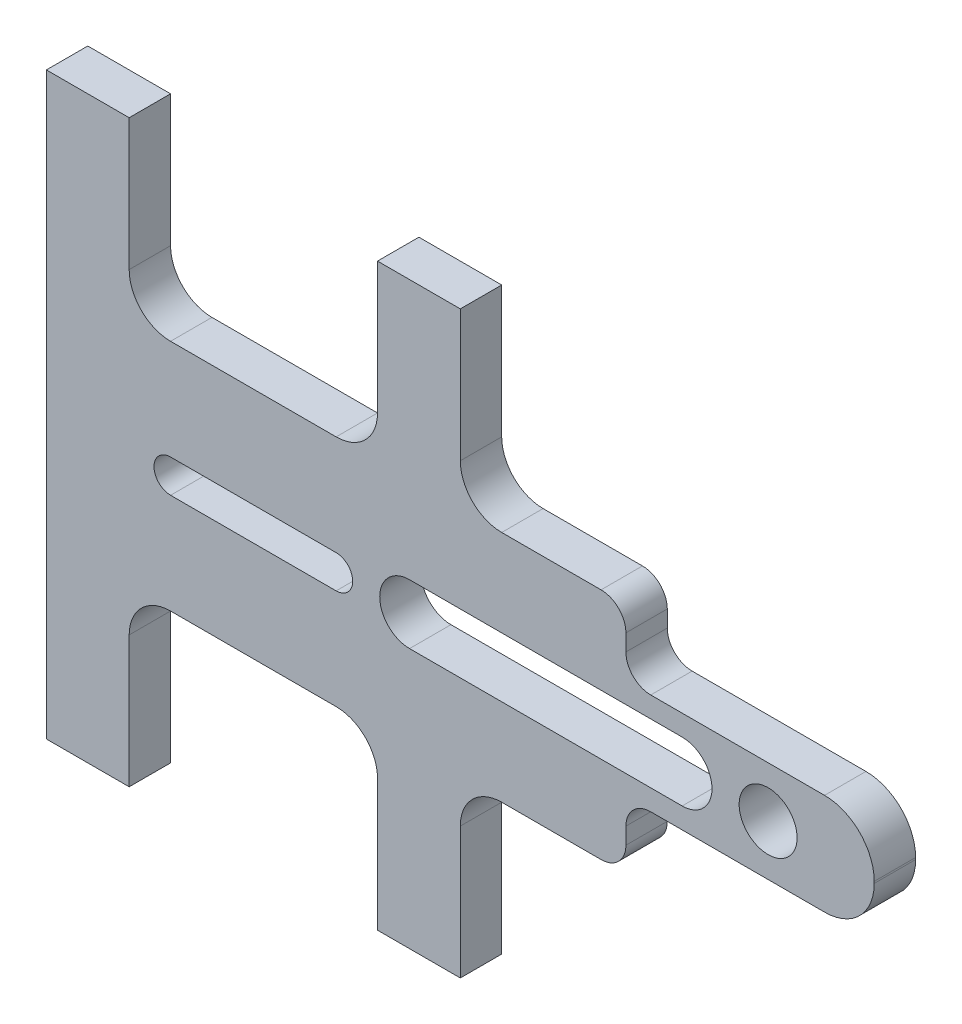
from build123d import *

# Parameters (mm, degrees)
SKETCH1_R           = 1.75
BOSS_EXTRUDE1_DEPTH = 2.5


with BuildPart() as part:
    # Sketch1 → Boss-Extrude1 (new body)
    with BuildSketch(Plane.XY):
        with BuildLine():
            Line((0, -17.5), (0, 17.5))
            Line((0, 17.5), (5, 17.5))
            Line((5, 17.5), (5, 9.554775034))
            ThreePointArc((5, 9.554775034), (5.732233047, 7.787008081), (7.5, 7.054775034))
            Line((7.5, 7.054775034), (17.5, 7.054775034))
            ThreePointArc((17.5, 7.054775034), (19.267766953, 7.787008081), (20, 9.554775034))
            Line((20, 9.554775034), (20, 17.5))
            Line((20, 17.5), (25, 17.5))
            Line((25, 17.5), (25, 9.554775034))
            ThreePointArc((25, 9.554775034), (25.732233047, 7.787008081), (27.5, 7.054775034))
            Line((27.5, 7.054775034), (33.501638743, 7.054775034))
            ThreePointArc((33.501638743, 7.054775034), (34.562298915, 6.615435205), (35.001638743, 5.554775034))
            Line((35.001638743, 5.554775034), (35.001638743, 4.554775034))
            ThreePointArc((35.001638743, 4.554775034), (35.440978571, 3.494114862), (36.501638743, 3.054775034))
            Line((36.501638743, 3.054775034), (47, 3.054775034))
            ThreePointArc((47, 3.054775034), (49.121320344, 2.176095377), (50, 0.054775034))
            Line((50, 0.054775034), (50, -0.054775034))
            ThreePointArc((50, -0.054775034), (49.121320344, -2.176095377), (47, -3.054775034))
            Line((47, -3.054775034), (36.501638743, -3.054775034))
            ThreePointArc((36.501638743, -3.054775034), (35.440978571, -3.494114862), (35.001638743, -4.554775034))
            Line((35.001638743, -4.554775034), (35.001638743, -5.554775034))
            ThreePointArc((35.001638743, -5.554775034), (34.562298915, -6.615435205), (33.501638743, -7.054775034))
            Line((33.501638743, -7.054775034), (27.5, -7.054775034))
            ThreePointArc((27.5, -7.054775034), (25.732233047, -7.787008081), (25, -9.554775034))
            Line((25, -9.554775034), (25, -17.5))
            Line((25, -17.5), (20, -17.5))
            Line((20, -17.5), (20, -9.554775034))
            ThreePointArc((20, -9.554775034), (19.267766953, -7.787008081), (17.5, -7.054775034))
            Line((17.5, -7.054775034), (7.5, -7.054775034))
            ThreePointArc((7.5, -7.054775034), (5.732233047, -7.787008081), (5, -9.554775034))
            Line((5, -9.554775034), (5, -17.5))
            Line((5, -17.5), (0, -17.5))
        make_face()
        with Locations((43.591641256, 0)):
            Circle(SKETCH1_R, mode=Mode.SUBTRACT)
        with BuildLine():
            Line((7.5, 1), (17.5, 1))
            ThreePointArc((17.5, 1), (18.5, 0), (17.5, -1))
            Line((17.5, -1), (7.5, -1))
            ThreePointArc((7.5, -1), (6.5, 0), (7.5, 1))
        make_face(mode=Mode.SUBTRACT)
        with BuildLine():
            Line((21.935113123, 1.8014467), (38.399570766, 1.8014467))
            ThreePointArc((38.399570766, 1.8014467), (40.201017466, 0), (38.399570766, -1.8014467))
            Line((38.399570766, -1.8014467), (21.935113123, -1.8014467))
            ThreePointArc((21.935113123, -1.8014467), (20.133666423, 0), (21.935113123, 1.8014467))
        make_face(mode=Mode.SUBTRACT)
    extrude(amount=BOSS_EXTRUDE1_DEPTH)


solid = part.part
